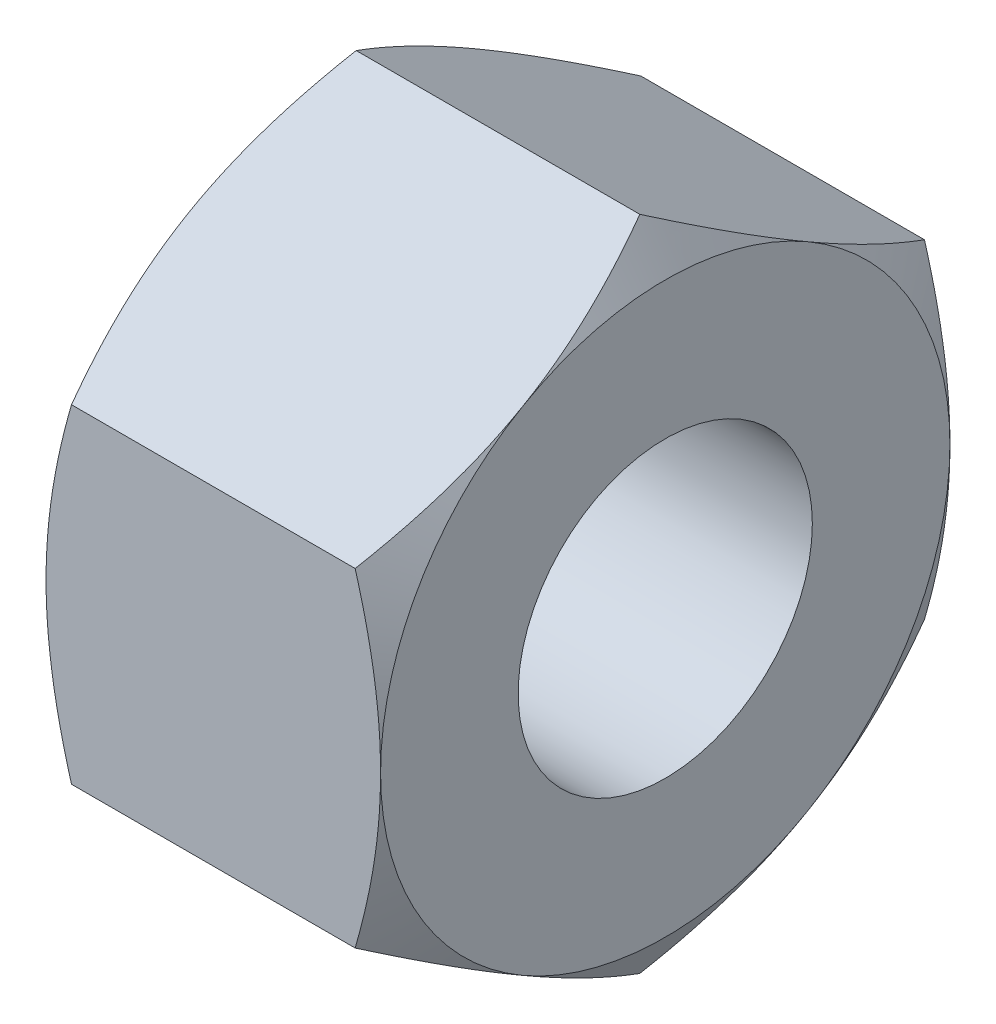
from build123d import *

# Parameters (mm, degrees)
BOSS_EXTRUDE1_DEPTH = 4.7
SKETCH2_OUTSIDE_W   = 42.786
SKETCH2_OUTSIDE_H   = 44.024
SKETCH2_OUTSIDE_R   = 4
CUT_EXTRUDE1_DEPTH  = 8.708653147
CUT_EXTRUDE1_DRAFT  = -60
SKETCH3_OUTSIDE_W   = 42.786
SKETCH3_OUTSIDE_H   = 44.024
SKETCH3_OUTSIDE_R   = 4
CUT_EXTRUDE2_DEPTH  = 8.708653147
CUT_EXTRUDE2_DRAFT  = -60
TAP1_D              = 4.134


with BuildPart() as part:
    # Sketch1 → Boss-Extrude1 (new body)
    with BuildSketch(Plane(origin=(0, 0, 0), x_dir=(0, 0, -1), z_dir=(1, 0, 0))):
        Polygon((0, 4.618802154), (-4, 2.309401077), (-4, -2.309401077), (0, -4.618802154), (4, -2.309401077), (4, 2.309401077), align=None)
    extrude(amount=-BOSS_EXTRUDE1_DEPTH)


with BuildPart() as cut_extrude1_tool:
    # Sketch2 outside → Cut-Extrude1 (with draft: the straight prism first)
    with BuildSketch(Plane(origin=(0, 0, 0), x_dir=(0, 0, -1), z_dir=(1, 0, 0))):
        Rectangle(SKETCH2_OUTSIDE_W, SKETCH2_OUTSIDE_H)
        Circle(SKETCH2_OUTSIDE_R, mode=Mode.SUBTRACT)
    extrude(amount=-CUT_EXTRUDE1_DEPTH)
    # Cut-Extrude1: the draft: its side faces are tilted about the plane it starts from
    cut_extrude1_sides = [cut_extrude1_tool.faces().sort_by_distance(p)[0] for p in [
        (-4.354326573, -22.012, 0),
        (-4.354326573, 0, -21.393),
        (-4.354326573, 22.012, 0),
        (-4.354326573, 0, 21.393),
        (-4.354326573, 0, 4),
    ]]
    draft(cut_extrude1_sides, Plane(origin=(0, 0, 0), x_dir=(0, 0, -1), z_dir=(1, 0, 0)), CUT_EXTRUDE1_DRAFT)


with BuildPart() as part_1:
    add(part.part)

    # Cut-Extrude1: cut by cut_extrude1_tool
    add(cut_extrude1_tool.part, mode=Mode.SUBTRACT)


with BuildPart() as cut_extrude2_tool:
    # Sketch3 outside → Cut-Extrude2 (with draft: the straight prism first)
    with BuildSketch(Plane.ZY.offset(4.7)):
        Rectangle(SKETCH3_OUTSIDE_W, SKETCH3_OUTSIDE_H)
        Circle(SKETCH3_OUTSIDE_R, mode=Mode.SUBTRACT)
    extrude(amount=-CUT_EXTRUDE2_DEPTH)
    # Cut-Extrude2: the draft: its side faces are tilted about the plane it starts from
    cut_extrude2_sides = [cut_extrude2_tool.faces().sort_by_distance(p)[0] for p in [
        (-0.345673427, -22.012, 0),
        (-0.345673427, 0, 21.393),
        (-0.345673427, 22.012, 0),
        (-0.345673427, 0, -21.393),
        (-0.345673427, 0, -4),
    ]]
    draft(cut_extrude2_sides, Plane.ZY.offset(4.7), CUT_EXTRUDE2_DRAFT)


with BuildPart() as part_2:
    add(part_1.part)

    # Cut-Extrude2: cut by cut_extrude2_tool
    add(cut_extrude2_tool.part, mode=Mode.SUBTRACT)

    # Tap1 (through all)
    with Locations(Plane(origin=(0, 0, 0), x_dir=(0, 0, -1), z_dir=(1, 0, 0))):
        with Locations((0, 0)):
            Hole(TAP1_D / 2)


solid = part_2.part
